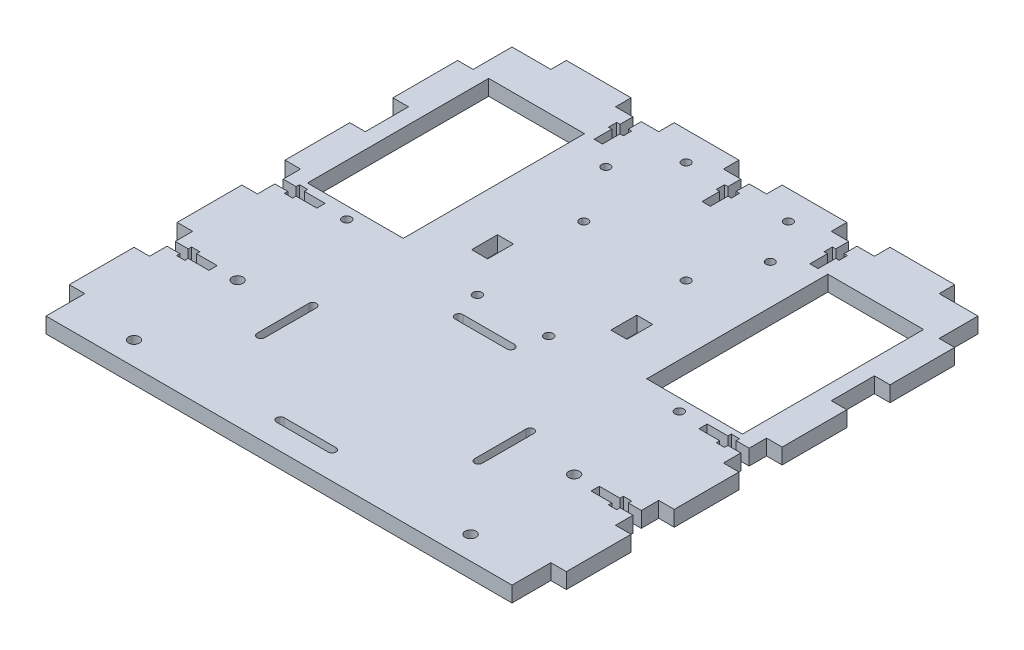
from build123d import *

# Parameters (mm, degrees)
SKETCH1_R           = 2.1
SKETCH1_R_2         = 1.65
SKETCH1_R_3         = 1.7
SKETCH1_W           = 6.2
SKETCH1_H           = 10
SKETCH1_W_2         = 37
SKETCH1_H_2         = 70
BOSS_EXTRUDE1_DEPTH = 6


with BuildPart() as part:
    # Sketch1 → Boss-Extrude1 (new body)
    with BuildSketch(Plane(origin=(0, 0, 0), x_dir=(1, 0, 0), z_dir=(0, 1, 0))):
        Polygon((-90, -90), (90, -90), (90, -75), (96, -75), (96, -50), (90, -50), (90, -43.266666667), (85, -43.266666667), (85, -44.566666667), (81.8, -44.566666667), (81.8, -43.266666667), (73.8, -43.266666667), (73.8, -40.066666667), (81.8, -40.066666667), (81.8, -38.766666667), (85, -38.766666667), (85, -40.066666667), (90, -40.066666667), (90, -33.333333333), (96, -33.333333333), (96, -8.333333333), (90, -8.333333333), (90, -1.6), (85, -1.6), (85, -2.9), (81.8, -2.9), (81.8, -1.6), (73.8, -1.6), (73.8, 1.6), (81.8, 1.6), (81.8, 2.9), (85, 2.9), (85, 1.6), (90, 1.6), (90, 8.333333333), (96, 8.333333333), (96, 33.333333333), (90, 33.333333333), (90, 50), (96, 50), (96, 75), (90, 75), (90, 90), (75, 90), (75, 96), (50, 96), (50, 90), (43.266666667, 90), (43.266666667, 85), (44.566666667, 85), (44.566666667, 81.8), (43.266666667, 81.8), (43.266666667, 75), (40.066666667, 75), (40.066666667, 81.8), (38.766666667, 81.8), (38.766666667, 85), (40.066666667, 85), (40.066666667, 90), (33.333333333, 90), (33.333333333, 96), (8.333333333, 96), (8.333333333, 90), (1.6, 90), (1.6, 85), (2.9, 85), (2.9, 81.8), (1.6, 81.8), (1.6, 75), (-1.6, 75), (-1.6, 81.8), (-2.9, 81.8), (-2.9, 85), (-1.6, 85), (-1.6, 90), (-8.333333333, 90), (-8.333333333, 96), (-33.333333333, 96), (-33.333333333, 90), (-40.066666667, 90), (-40.066666667, 85), (-38.766666667, 85), (-38.766666667, 81.8), (-40.066666667, 81.8), (-40.066666667, 75), (-43.266666667, 75), (-43.266666667, 81.8), (-44.566666667, 81.8), (-44.566666667, 85), (-43.266666667, 85), (-43.266666667, 90), (-50, 90), (-50, 96), (-75, 96), (-75, 90), (-90, 90), (-90, 75), (-96, 75), (-96, 50), (-90, 50), (-90, 33.333333333), (-96, 33.333333333), (-96, 8.333333333), (-90, 8.333333333), (-90, 1.6), (-85, 1.6), (-85, 2.9), (-81.8, 2.9), (-81.8, 1.6), (-73.8, 1.6), (-73.8, -1.6), (-81.8, -1.6), (-81.8, -2.9), (-85, -2.9), (-85, -1.6), (-90, -1.6), (-90, -8.333333333), (-96, -8.333333333), (-96, -33.333333333), (-90, -33.333333333), (-90, -40.066666667), (-85, -40.066666667), (-85, -38.766666667), (-81.8, -38.766666667), (-81.8, -40.066666667), (-73.8, -40.066666667), (-73.8, -43.266666667), (-81.8, -43.266666667), (-81.8, -44.566666667), (-85, -44.566666667), (-85, -43.266666667), (-90, -43.266666667), (-90, -50), (-96, -50), (-96, -75), (-90, -75), align=None)
        with Locations(Location((65, -41, 0), (0, 0, 270))):
            Circle(SKETCH1_R, mode=Mode.SUBTRACT)
        with Locations(Location((65, -81, 0), (0, 0, 270))):
            Circle(SKETCH1_R, mode=Mode.SUBTRACT)
        with Locations(Location((-65, -81, 0), (0, 0, 90))):
            Circle(SKETCH1_R, mode=Mode.SUBTRACT)
        with Locations(Location((-65, -41, 0), (0, 0, 90))):
            Circle(SKETCH1_R, mode=Mode.SUBTRACT)
        with Locations(Location((21.75, 45.5, 0), (0, 0, 270))):
            Circle(SKETCH1_R_2, mode=Mode.SUBTRACT)
        with Locations(Location((-17.75, 45.5, 0), (0, 0, 270))):
            Circle(SKETCH1_R_2, mode=Mode.SUBTRACT)
        with Locations(Location((-17.75, 85, 0), (0, 0, 270))):
            Circle(SKETCH1_R_2, mode=Mode.SUBTRACT)
        with Locations(Location((21.75, 85, 0), (0, 0, 270))):
            Circle(SKETCH1_R_2, mode=Mode.SUBTRACT)
        with Locations(Location((-31.75, 68, 0), (0, 0, 270))):
            Circle(SKETCH1_R_2, mode=Mode.SUBTRACT)
        with Locations(Location((31.75, 68, 0), (0, 0, 270))):
            Circle(SKETCH1_R_2, mode=Mode.SUBTRACT)
        with Locations(Location((-13.770355578, 0.4, 0), (0, 0, 270))):
            Circle(SKETCH1_R_3, mode=Mode.SUBTRACT)
        with Locations(Location((13.770355578, 0.4, 0), (0, 0, 270))):
            Circle(SKETCH1_R_3, mode=Mode.SUBTRACT)
        with Locations(Location((64.229644422, 0.4, 0), (0, 0, 270))):
            Circle(SKETCH1_R_3, mode=Mode.SUBTRACT)
        with Locations(Location((-64.229644422, 0.4, 0), (0, 0, 270))):
            Circle(SKETCH1_R_3, mode=Mode.SUBTRACT)
        with Locations((26.9, 19.4)):
            Rectangle(SKETCH1_W, SKETCH1_H, mode=Mode.SUBTRACT)
        with Locations((65.5, 40)):
            Rectangle(SKETCH1_W_2, SKETCH1_H_2, mode=Mode.SUBTRACT)
        with Locations((-65.5, 40)):
            Rectangle(SKETCH1_W_2, SKETCH1_H_2, mode=Mode.SUBTRACT)
        with Locations((-26.9, 19.4)):
            Rectangle(SKETCH1_W, SKETCH1_H, mode=Mode.SUBTRACT)
        with BuildLine():
            Line((-40.5, -35), (-40.5, -55))
            ThreePointArc((-40.5, -55), (-42, -56.5), (-43.5, -55))
            Line((-43.5, -55), (-43.5, -35))
            ThreePointArc((-43.5, -35), (-42, -33.5), (-40.5, -35))
        make_face(mode=Mode.SUBTRACT)
        with BuildLine():
            Line((40.5, -35), (40.5, -55))
            ThreePointArc((40.5, -55), (42, -56.5), (43.5, -55))
            Line((43.5, -55), (43.5, -35))
            ThreePointArc((43.5, -35), (42, -33.5), (40.5, -35))
        make_face(mode=Mode.SUBTRACT)
        with BuildLine():
            Line((10, -12), (-10, -12))
            ThreePointArc((-10, -12), (-11.5, -10.5), (-10, -9))
            Line((-10, -9), (10, -9))
            ThreePointArc((10, -9), (11.5, -10.5), (10, -12))
        make_face(mode=Mode.SUBTRACT)
        with BuildLine():
            Line((10, -78), (-10, -78))
            ThreePointArc((-10, -78), (-11.5, -79.5), (-10, -81))
            Line((-10, -81), (10, -81))
            ThreePointArc((10, -81), (11.5, -79.5), (10, -78))
        make_face(mode=Mode.SUBTRACT)
    extrude(amount=BOSS_EXTRUDE1_DEPTH)


solid = part.part
